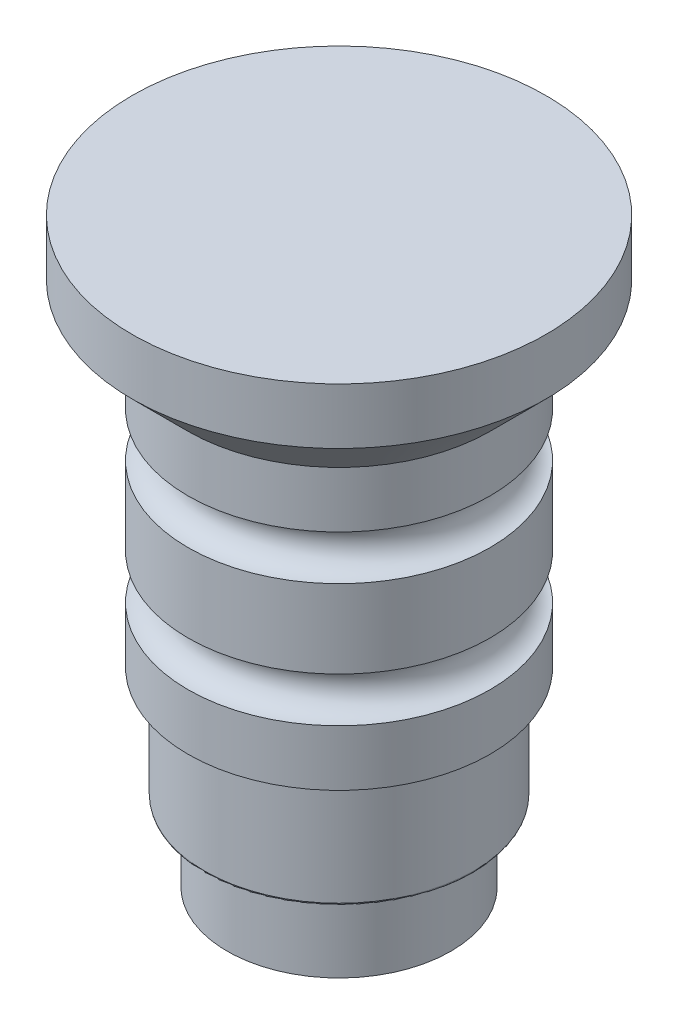
from build123d import *

# Parameters (mm, degrees)
CONG_3_R = 0.2


with BuildPart() as part:
    # Esquisse1 → Révolution1 (revolve)
    with BuildSketch(Plane.XY):
        with BuildLine():
            Line((-7.5, 0), (-10, 0))
            Line((-10, 0), (-10, 7))
            Line((-10, 7), (-12, 7))
            Line((-12, 7), (-12, 17))
            Line((-12, 17), (-13.5, 17))
            Line((-13.5, 17), (-13.5, 22))
            ThreePointArc((-13.5, 22), (-11.5, 24), (-13.5, 26))
            Line((-13.5, 26), (-13.5, 33))
            ThreePointArc((-13.5, 33), (-11.5, 35), (-13.5, 37))
            Line((-13.5, 37), (-13.5, 42))
            Line((-13.5, 42), (-18.5, 47))
            Line((-18.5, 47), (-18.5, 52))
            Line((-18.5, 52), (0, 52))
            Line((0, 52), (0, 42))
            Line((0, 42), (0, 12))
            Line((0, 12), (-7.5, 12))
            Line((-7.5, 12), (-7.5, 0))
        make_face()
    revolve(axis=Axis((0, 42, 0), (0, -1, 0)))

    # Congé3
    cong_3_edges = [part.edges().sort_by_distance(p)[0] for p in [
        (12, 7, 0),
        (10, 7, 0),
    ]]
    fillet(cong_3_edges, radius=CONG_3_R)


solid = part.part
